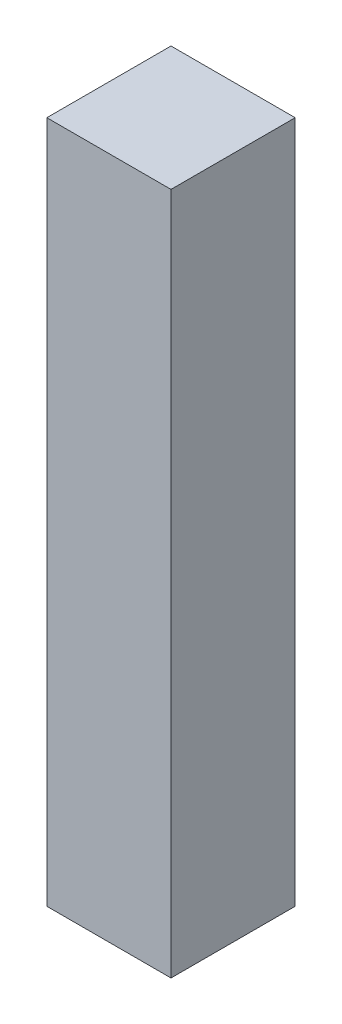
from build123d import *

# Parameters (mm, degrees)
SKETCH1_W           = 100
SKETCH1_H           = 100
BOSS_EXTRUDE1_DEPTH = 550


with BuildPart() as part:
    # Sketch1 → Boss-Extrude1 (new body)
    with BuildSketch(Plane(origin=(0, 0, 0), x_dir=(1, 0, 0), z_dir=(0, 1, 0))):
        Rectangle(SKETCH1_W, SKETCH1_H)
    extrude(amount=BOSS_EXTRUDE1_DEPTH)


solid = part.part
